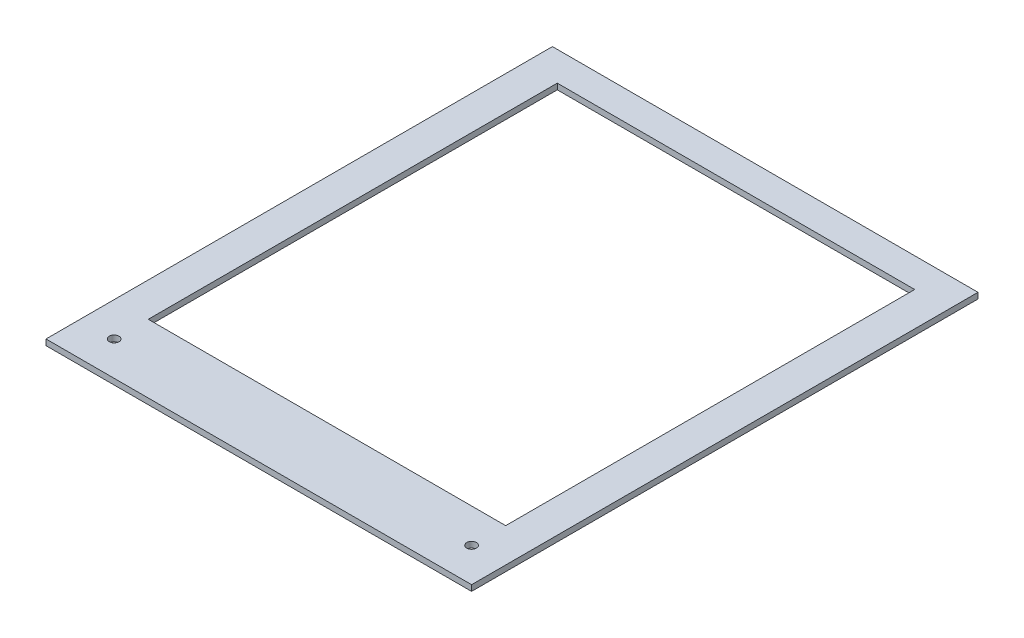
from build123d import *

# Parameters (mm, degrees)
SKETCH1_W           = 148.5
SKETCH1_H           = 35
BOSS_EXTRUDE1_DEPTH = 3


with BuildPart() as part:
    # Sketch1 → Boss-Extrude1 (new body)
    with BuildSketch(Plane(origin=(0, 0, 0), x_dir=(1, 0, 0), z_dir=(0, 1, 0))):
        Polygon((0, 105), (0, 120), (-91.75, 120), (-91.75, 105), (-74.25, 105), align=None)
        Polygon((91.75, 105), (91.75, 120), (0, 120), (0, 105), (74.25, 105), align=None)
        Polygon((109.25, -105), (109.25, 120), (91.75, 120), (91.75, 105), (91.75, -105), align=None)
        Polygon((-91.75, 105), (-91.75, 120), (-109.25, 120), (-109.25, -105), (-91.75, -105), align=None)
        with BuildLine():
            Line((-109.25, -140), (-74.25, -140))
            Line((-74.25, -140), (-74.25, -105))
            Line((-74.25, -105), (-89.982233047, -120.732233047))
            ThreePointArc((-89.982233047, -120.732233047), (-89.440301169, -121.543291419), (-89.25, -122.5))
            ThreePointArc((-89.25, -122.5), (-90.793291419, -124.809698831), (-93.517766953, -124.267766953))
            Line((-93.517766953, -124.267766953), (-109.25, -140))
        make_face()
        with BuildLine():
            Line((-89.982233047, -120.732233047), (-74.25, -105))
            Line((-74.25, -105), (-91.75, -105))
            Line((-91.75, -105), (-109.25, -105))
            Line((-109.25, -105), (-109.25, -140))
            Line((-109.25, -140), (-93.517766953, -124.267766953))
            ThreePointArc((-93.517766953, -124.267766953), (-93.517766953, -120.732233047), (-89.982233047, -120.732233047))
        make_face()
        with Locations((0, -122.5)):
            Rectangle(SKETCH1_W, SKETCH1_H)
        with BuildLine():
            Line((74.25, -140), (109.25, -140))
            Line((109.25, -140), (93.517766953, -124.267766953))
            ThreePointArc((93.517766953, -124.267766953), (89.982233047, -124.267766953), (89.982233047, -120.732233047))
            Line((89.982233047, -120.732233047), (74.25, -105))
            Line((74.25, -105), (74.25, -140))
        make_face()
        with BuildLine():
            Line((109.25, -140), (109.25, -105))
            Line((109.25, -105), (91.75, -105))
            Line((91.75, -105), (74.25, -105))
            Line((74.25, -105), (89.982233047, -120.732233047))
            ThreePointArc((89.982233047, -120.732233047), (92.706708581, -120.190301169), (94.25, -122.5))
            ThreePointArc((94.25, -122.5), (94.059698831, -123.456708581), (93.517766953, -124.267766953))
            Line((93.517766953, -124.267766953), (109.25, -140))
        make_face()
    extrude(amount=BOSS_EXTRUDE1_DEPTH)


solid = part.part
